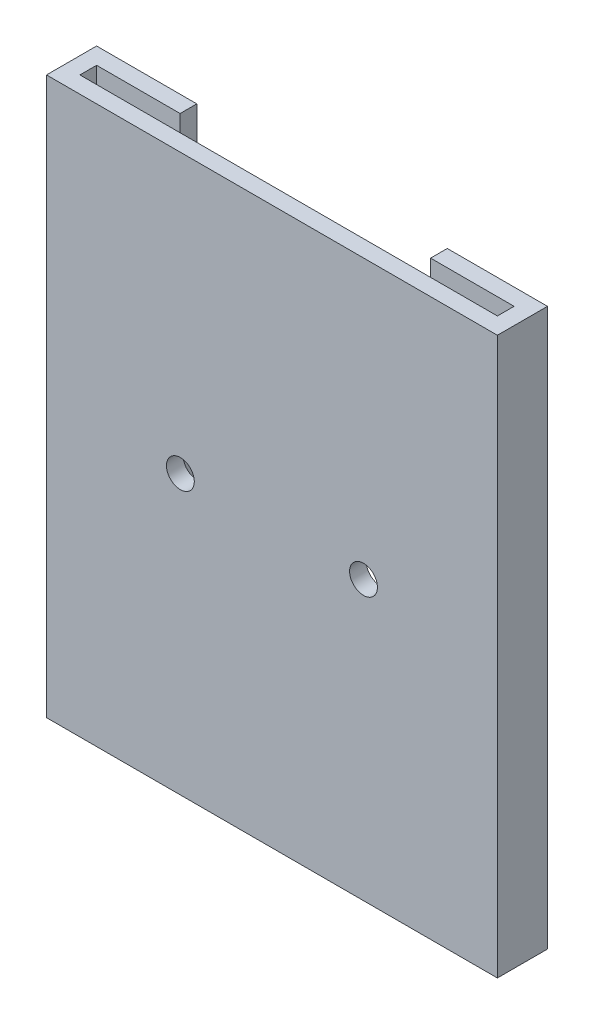
from build123d import *

# Parameters (mm, degrees)
BOSS_EXTRUDE1_DEPTH = 200
SKETCH2_R           = 5
CUT_EXTRUDE1_DEPTH  = 244.385010939


with BuildPart() as part:
    # Sketch1 → Boss-Extrude1 (new body)
    with BuildSketch(Plane(origin=(0, 0, 0), x_dir=(1, 0, 0), z_dir=(0, 1, 0))):
        Polygon((-12.174757282, 0), (17.825242718, 0), (17.825242718, -6), (-132.174757282, -6), (-132.174757282, 0), (-102.174757282, 0), (-102.174757282, 6), (-138.174757282, 6), (-138.174757282, -12), (23.825242718, -12), (23.825242718, 6), (-12.174757282, 6), align=None)
    extrude(amount=BOSS_EXTRUDE1_DEPTH)

    # Sketch2 → Cut-Extrude1 (cut, through all)
    with BuildSketch(Plane(origin=(0, 0, 6), x_dir=(-1, 0, 0), z_dir=(0, 0, -1))):
        with Locations((24.274757282, 100)):
            Circle(SKETCH2_R)
        with Locations(Location((90.074757282, 100, 0), (0, 0, 180))):
            Circle(SKETCH2_R)
    extrude(amount=-CUT_EXTRUDE1_DEPTH, mode=Mode.SUBTRACT)


solid = part.part
